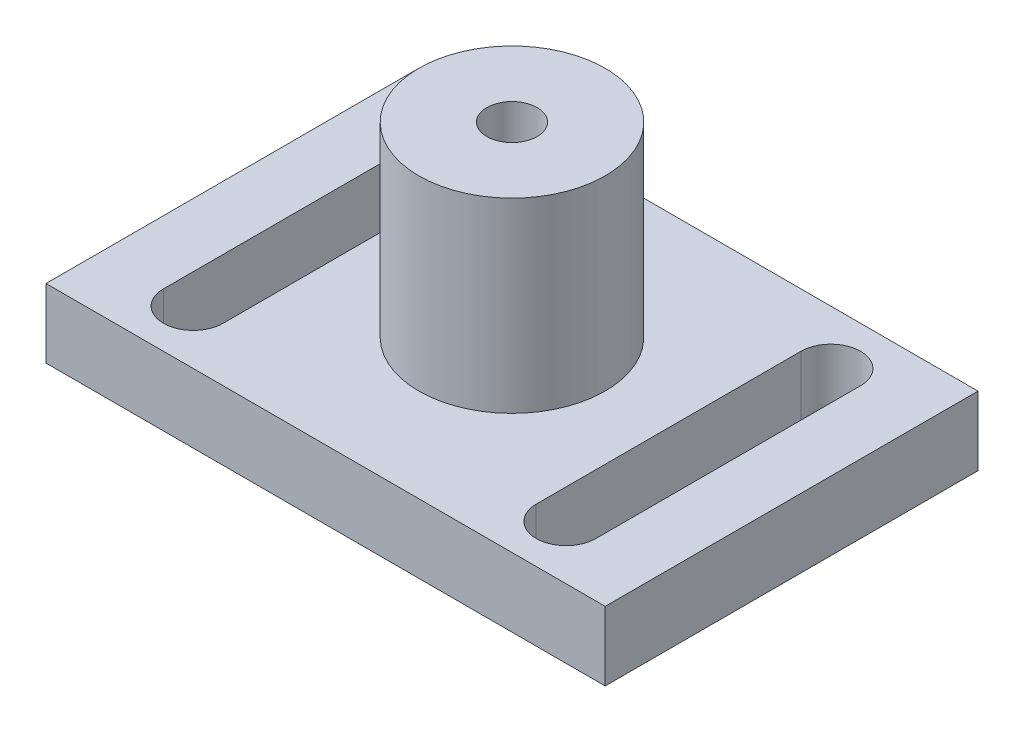
from build123d import *

# Parameters (mm, degrees)
SKETCH1_W           = 76.2
SKETCH1_H           = 50.8
BOSS_EXTRUDE1_DEPTH = 9.398
CUT_EXTRUDE1_DEPTH  = 9.398
SKETCH4_R           = 12.7
SKETCH4_R_2         = 3.429
BOSS_EXTRUDE2_DEPTH = 25.4


with BuildPart() as part:
    # Sketch1 → Boss-Extrude1 (new body)
    with BuildSketch(Plane(origin=(0, 0, 0), x_dir=(1, 0, 0), z_dir=(0, 1, 0))):
        with Locations((38.1, 25.4)):
            Rectangle(SKETCH1_W, SKETCH1_H)
    extrude(amount=BOSS_EXTRUDE1_DEPTH)

    # Sketch3 → Cut-Extrude1 (cut)
    with BuildSketch(Plane(origin=(0, 9.398, 0), x_dir=(1, 0, 0), z_dir=(0, 1, 0))):
        with BuildLine():
            Line((8.636, 43.434), (8.636, 7.366))
            ThreePointArc((8.636, 7.366), (12.7, 3.302), (16.764, 7.366))
            Line((16.764, 7.366), (16.764, 43.434))
            ThreePointArc((16.764, 43.434), (12.7, 47.498), (8.636, 43.434))
        make_face()
        with BuildLine():
            Line((67.564, 43.434), (67.564, 7.366))
            ThreePointArc((67.564, 7.366), (63.5, 3.302), (59.436, 7.366))
            Line((59.436, 7.366), (59.436, 43.434))
            ThreePointArc((59.436, 43.434), (63.5, 47.498), (67.564, 43.434))
        make_face()
    extrude(amount=-CUT_EXTRUDE1_DEPTH, mode=Mode.SUBTRACT)

    # Sketch4 → Boss-Extrude2 (add)
    with BuildSketch(Plane(origin=(0, 9.398, 0), x_dir=(1, 0, 0), z_dir=(0, 1, 0))):
        with Locations(Location((38.1, 25.4, 0), (0, 0, 270))):
            Circle(SKETCH4_R)
        with Locations(Location((38.1, 25.4, 0), (0, 0, 270))):
            Circle(SKETCH4_R_2, mode=Mode.SUBTRACT)
    extrude(amount=BOSS_EXTRUDE2_DEPTH)


solid = part.part
